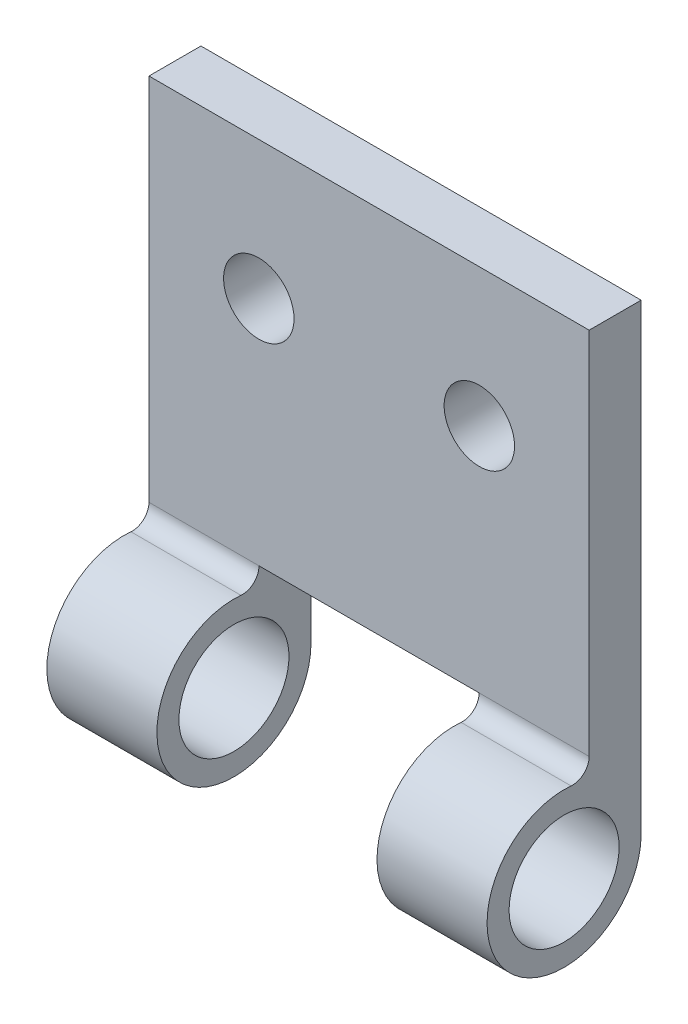
from build123d import *

# Parameters (mm, degrees)
SKETCH2_R               = 1.5875
BOSS_EXTRUDE1_DEPTH     = 12.7
SKETCH3_R               = 1.016
CUT_EXTRUDE1_DEPTH      = 12.7
CUT_EXTRUDE3_DEPTH      = 5.08
CUT_EXTRUDE3_DEPTH_BACK = 50.8
SKETCH4_W               = 6.35
SKETCH4_H               = 4.911764537
SCALE1_SCALE            = 3


with BuildPart() as part:
    # Sketch2 → Boss-Extrude1 (new body)
    with BuildSketch(Plane(origin=(0, 0, 0), x_dir=(0, 0, -1), z_dir=(1, 0, 0))):
        with BuildLine():
            Line((0.7234417, 2.689264537), (0.7234417, 13.340138709))
            Line((0.7234417, 13.340138709), (2.2225, 13.340138709))
            Line((2.2225, 13.340138709), (2.2225, 0))
            ThreePointArc((2.2225, 0), (-1.641425032, -1.498409194), (0.202045455, 2.213297062))
            ThreePointArc((0.202045455, 2.213297062), (0.567726646, 2.33627761), (0.7234417, 2.689264537))
        make_face()
        Circle(SKETCH2_R, mode=Mode.SUBTRACT)
    extrude(amount=BOSS_EXTRUDE1_DEPTH)

    # Sketch3 → Cut-Extrude1 (cut)
    with BuildSketch(Plane.XY.offset(-0.7234417)):
        with Locations((3.168860155, 9.364146191)):
            Circle(SKETCH3_R)
        with Locations((9.531139845, 9.364146191)):
            Circle(SKETCH3_R)
    extrude(amount=-CUT_EXTRUDE1_DEPTH, mode=Mode.SUBTRACT)

    # Sketch4 → Cut-Extrude3 (cut, two sides: drawn at the far end of the back side and taken through both)
    with BuildSketch(Plane.XY.offset(-0.7234417).offset(-CUT_EXTRUDE3_DEPTH_BACK)):
        with Locations((6.35, 0.233382268)):
            Rectangle(SKETCH4_W, SKETCH4_H)
    extrude(amount=CUT_EXTRUDE3_DEPTH + CUT_EXTRUDE3_DEPTH_BACK, mode=Mode.SUBTRACT)


with BuildPart() as part_1:
    # Scale1: scaled about (6.35, 6.161123686, -1.197561497)
    add(part.part.scale(SCALE1_SCALE).moved(Location((-12.7, -12.322247372, 2.395122994))))


solid = part_1.part
